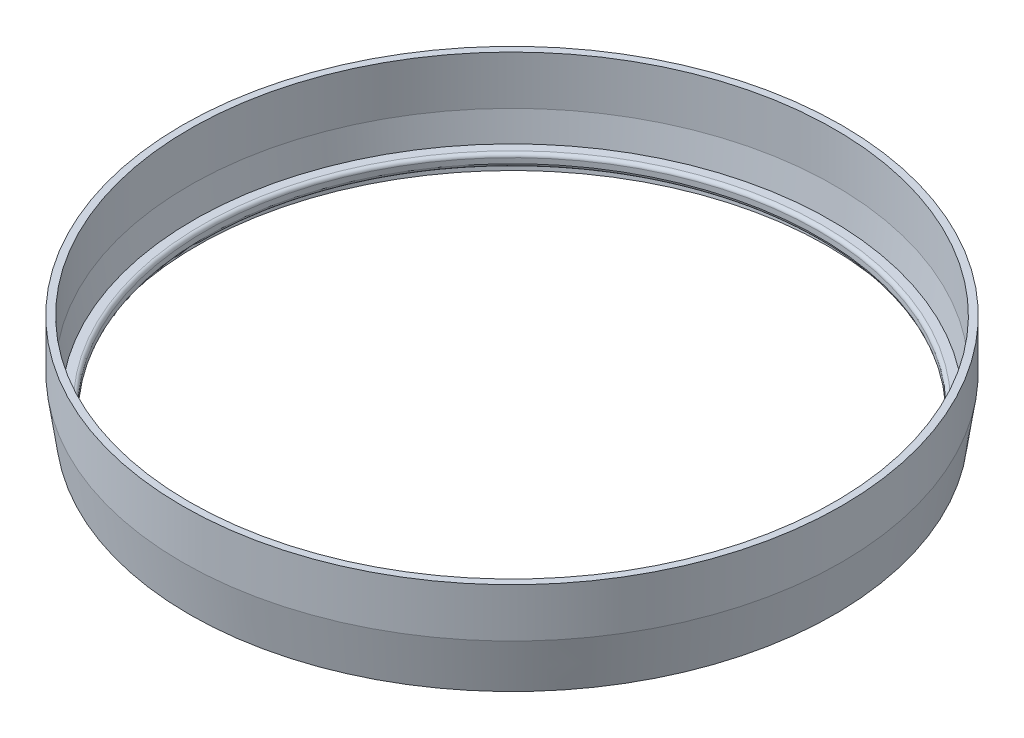
from build123d import *

# Parameters (mm, degrees)
FILLET1_R = 0.5


with BuildPart() as part:
    # Sketch1 → Revolve1 (revolve)
    with BuildSketch(Plane.XY, mode=Mode.PRIVATE) as revolve1_sk:
        Polygon((45.278810438, 0), (45.461165717, 1.25), (44, 1.25), (44, 3), (45.716463107, 3), (46.3, 7), (46.3, 14), (47.3, 14), (47.3, 7), (46.278810438, 0), align=None)
    revolve(revolve1_sk.sketch.rotate(Axis((0, 55, 0), (0, -1, 0)), 90), axis=Axis((0, 55, 0), (0, -1, 0)))

    # Fillet1
    fillet1_edges = [part.edges().sort_by_distance(p)[0] for p in [
        (0, 3, -44),
        (0, 1.25, -44),
    ]]
    fillet(fillet1_edges, radius=FILLET1_R)


solid = part.part
